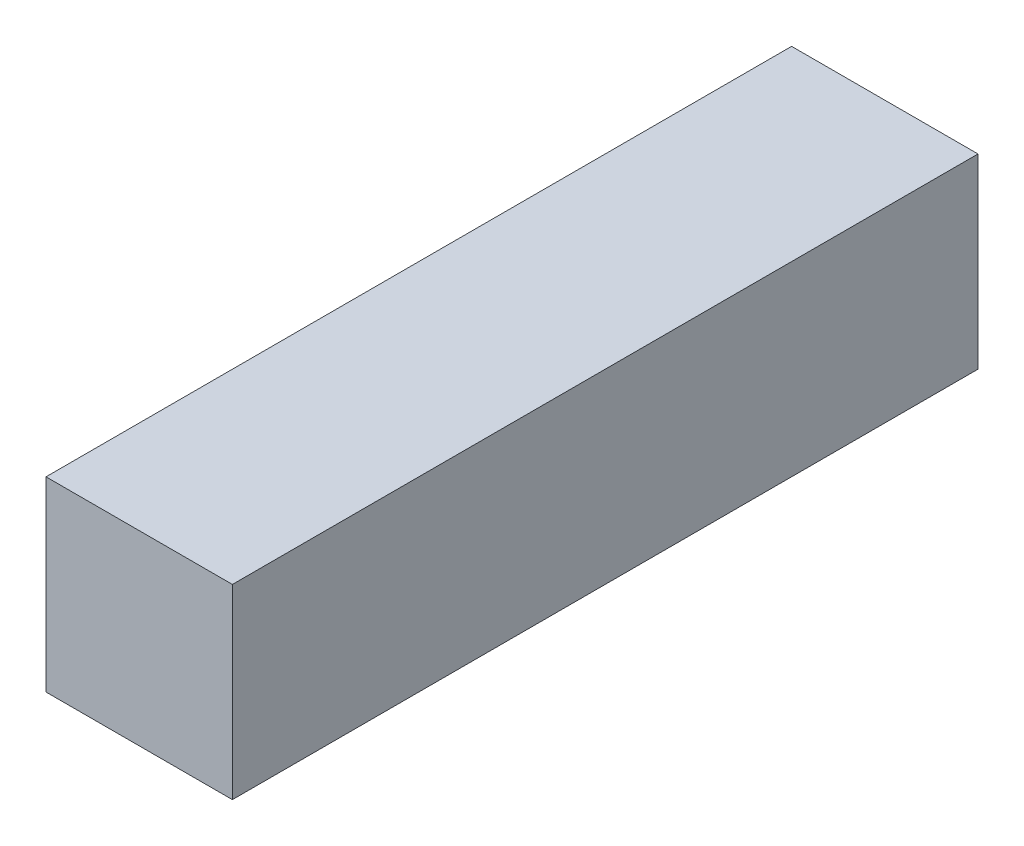
from build123d import *

# Parameters (mm, degrees)
CROQUIS1_W              = 5
CROQUIS1_H              = 5
SALIENTE_EXTRUIR1_DEPTH = 20


with BuildPart() as part:
    # Croquis1 → Saliente-Extruir1 (new body)
    with BuildSketch(Plane.XY):
        Rectangle(CROQUIS1_W, CROQUIS1_H)
    extrude(amount=SALIENTE_EXTRUIR1_DEPTH)


solid = part.part
